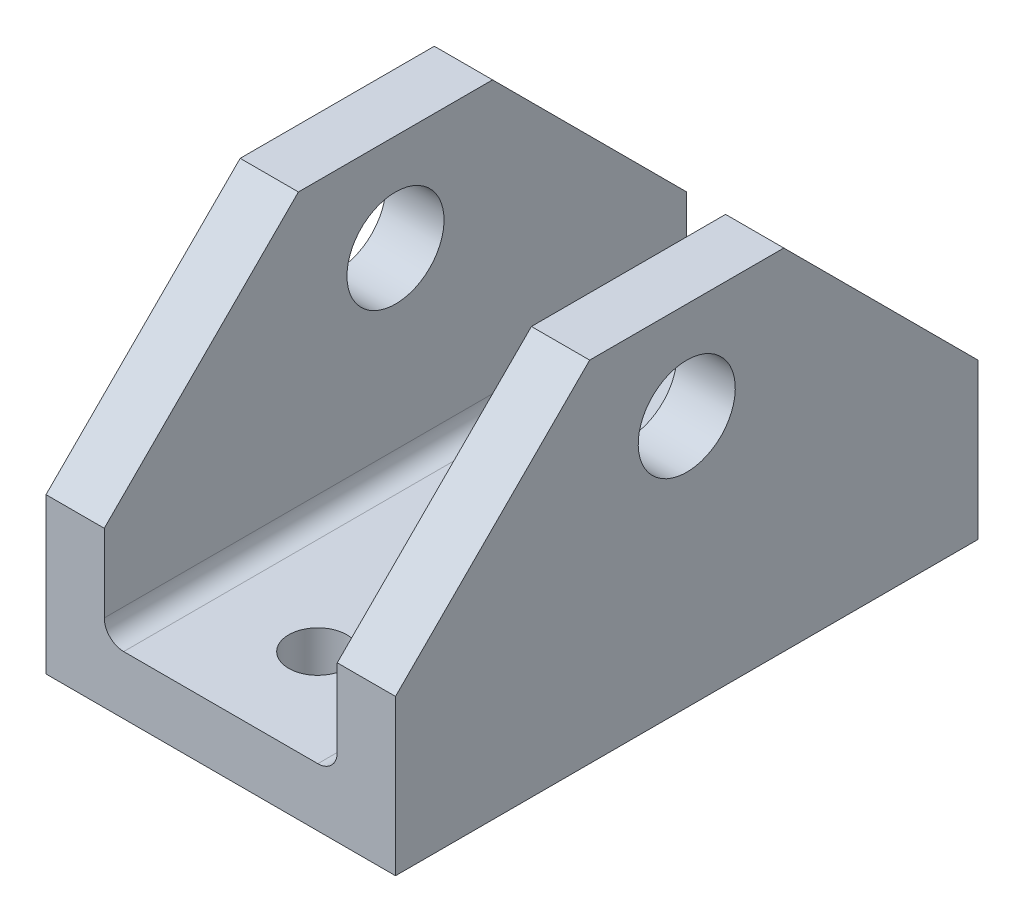
from build123d import *

# Parameters (mm, degrees)
BOSS_EXTRUDE1_DEPTH = 15
SKETCH3_R           = 1.5
CUT_EXTRUDE1_DEPTH  = 3
CUT_EXTRUDE2_REACH  = 29.821
SKETCH4_R           = 2.5
FILLET1_R           = 1


with BuildPart() as part:
    # Sketch1 → Boss-Extrude1 (new, symmetric)
    with BuildSketch(Plane.XY):
        Polygon((-6, 0), (6, 0), (6, 15), (9, 15), (9, -3), (-9, -3), (-9, 15), (-6, 15), align=None)
    extrude(amount=BOSS_EXTRUDE1_DEPTH, both=True)

    # Sketch3 → Cut-Extrude1 (cut)
    with BuildSketch(Plane(origin=(0, 0, 0), x_dir=(1, 0, 0), z_dir=(0, 1, 0))):
        with Locations(Location((0, 10, 0), (0, 0, 270))):
            Circle(SKETCH3_R)
        with Locations(Location((0, -10, 0), (0, 0, 90))):
            Circle(SKETCH3_R)
    extrude(amount=-CUT_EXTRUDE1_DEPTH, mode=Mode.SUBTRACT)

    # Cut-Extrude2: up to this face of the body (flat: up to its plane)
    cut_extrude2_end = Plane(part.part.faces().sort_by_distance((-9, 6, 0))[0])
    # Sketch4 → Cut-Extrude2 (cut, up to the picked face)
    with BuildSketch(Plane(origin=(9, 0, 0), x_dir=(0, 0, -1), z_dir=(1, 0, 0)), mode=Mode.PRIVATE) as cut_extrude2_sk1:
        with Locations(Location((0, 10, 0), (0, 0, 90))):
            Circle(SKETCH4_R)
    cut_extrude2_tool1 = split(extrude(cut_extrude2_sk1.sketch, amount=-CUT_EXTRUDE2_REACH, mode=Mode.PRIVATE), bisect_by=cut_extrude2_end, keep=Keep.BOTH, mode=Mode.PRIVATE)
    # Sketch4 → Cut-Extrude2 (cut, up to the picked face)
    with BuildSketch(Plane(origin=(9, 0, 0), x_dir=(0, 0, -1), z_dir=(1, 0, 0)), mode=Mode.PRIVATE) as cut_extrude2_sk2:
        Polygon((-15, 15), (-5, 15), (-15, 5), align=None)
    cut_extrude2_tool2 = split(extrude(cut_extrude2_sk2.sketch, amount=-CUT_EXTRUDE2_REACH, mode=Mode.PRIVATE), bisect_by=cut_extrude2_end, keep=Keep.BOTH, mode=Mode.PRIVATE)
    # Sketch4 → Cut-Extrude2 (cut, up to the picked face)
    with BuildSketch(Plane(origin=(9, 0, 0), x_dir=(0, 0, -1), z_dir=(1, 0, 0)), mode=Mode.PRIVATE) as cut_extrude2_sk3:
        Polygon((15, 5), (5, 15), (15, 15), align=None)
    cut_extrude2_tool3 = split(extrude(cut_extrude2_sk3.sketch, amount=-CUT_EXTRUDE2_REACH, mode=Mode.PRIVATE), bisect_by=cut_extrude2_end, keep=Keep.BOTH, mode=Mode.PRIVATE)
    add(cut_extrude2_tool1.solids().sort_by(Axis((9, 10, 0), (-1, 0, 0)))[0], mode=Mode.SUBTRACT)
    add(cut_extrude2_tool2.solids().sort_by(Axis((9, 11.666667, 11.666667), (-1, 0, 0)))[0], mode=Mode.SUBTRACT)
    add(cut_extrude2_tool3.solids().sort_by(Axis((9, 11.666667, -11.666667), (-1, 0, 0)))[0], mode=Mode.SUBTRACT)

    # Fillet1
    fillet1_edges = [part.edges().sort_by_distance(p)[0] for p in [
        (-6, 0, 0),
        (6, 0, 0),
    ]]
    fillet(fillet1_edges, radius=FILLET1_R)


solid = part.part
